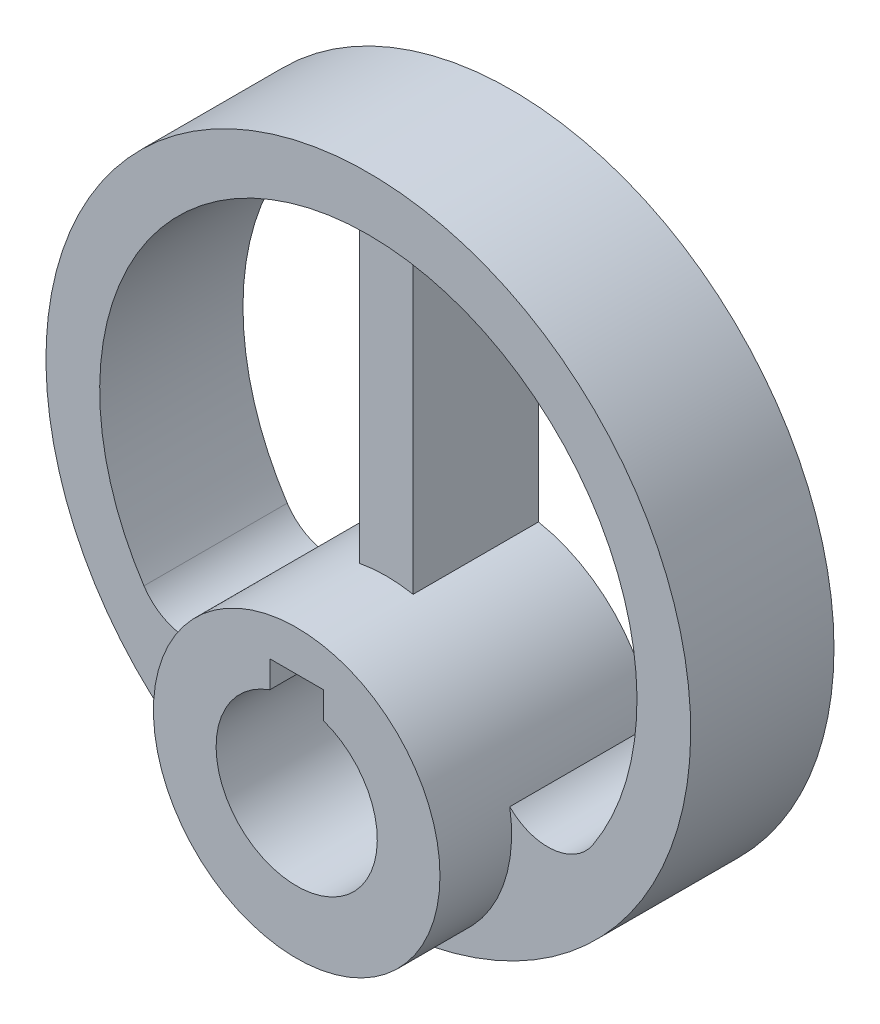
from build123d import *

# Parameters (mm, degrees)
SKETCH1_R           = 57.15
BOSS_EXTRUDE5_DEPTH = 25.4
SKETCH4_R           = 25.4
BOSS_EXTRUDE7_DEPTH = 12.7
SKETCH5_W           = 9.525
SKETCH5_H           = 56.448043325
BOSS_EXTRUDE8_DEPTH = 22.225


with BuildPart() as part:
    # Sketch1 → Boss-Extrude5 (new body)
    with BuildSketch(Plane.XY):
        Circle(SKETCH1_R)
        with BuildLine():
            Line((-4.7625, -18.279615818), (-4.7625, -13.517115818))
            Line((-4.7625, -13.517115818), (4.7625, -13.517115818))
            Line((4.7625, -13.517115818), (4.7625, -18.279615818))
            ThreePointArc((4.7625, -18.279615818), (0, -46.0375), (-4.7625, -18.279615818))
        make_face(mode=Mode.SUBTRACT)
        with BuildLine():
            ThreePointArc((-25.069578471, -27.666345352), (-32.776314377, -30.426898024), (-39.77908045, -26.187122475))
            ThreePointArc((-39.77908045, -26.187122475), (-45.621372905, -13.668612193), (-47.625, 0))
            ThreePointArc((-47.625, 0), (0, 47.625), (47.625, 0))
            ThreePointArc((47.625, 0), (45.621372905, -13.668612193), (39.77908045, -26.187122475))
            ThreePointArc((39.77908045, -26.187122475), (32.776314377, -30.426898024), (25.069578471, -27.666345352))
            ThreePointArc((25.069578471, -27.666345352), (0, -6.35), (-25.069578471, -27.666345352))
        make_face(mode=Mode.SUBTRACT)
    extrude(amount=BOSS_EXTRUDE5_DEPTH)

    # Sketch4 → Boss-Extrude7 (add)
    with BuildSketch(Plane.XY.offset(25.4)):
        with Locations(Location((0, -31.75, 0), (0, 0, 170.748186525))):
            Circle(SKETCH4_R)
        with BuildLine():
            Line((-4.7625, -18.279615818), (-4.7625, -13.517115818))
            Line((-4.7625, -13.517115818), (4.7625, -13.517115818))
            Line((4.7625, -13.517115818), (4.7625, -18.279615818))
            ThreePointArc((4.7625, -18.279615818), (0, -46.0375), (-4.7625, -18.279615818))
        make_face(mode=Mode.SUBTRACT)
    extrude(amount=BOSS_EXTRUDE7_DEPTH)

    # Sketch5 → Boss-Extrude8 (add)
    with BuildSketch(Plane.XY):
        with Locations((0, 20.552658513)):
            Rectangle(SKETCH5_W, SKETCH5_H)
    extrude(amount=BOSS_EXTRUDE8_DEPTH)


solid = part.part
